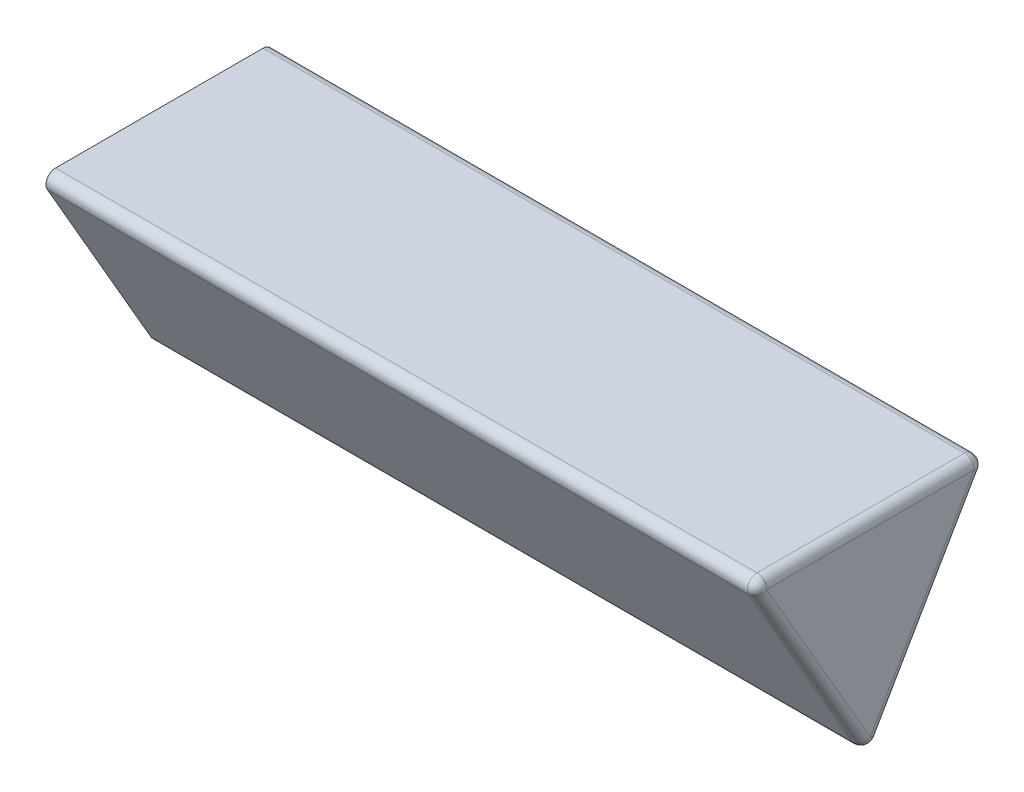
from build123d import *

# Parameters (mm, degrees)
BOSS_EXTRUDE2_DEPTH = 187.452
CUT_EXTRUDE1_DEPTH  = 186.182
FILLET1_R           = 2.54
FILLET2_R           = 2.54


with BuildPart() as part:
    # Sketch2 → Boss-Extrude2 (new body)
    with BuildSketch(Plane(origin=(0, 0, 0), x_dir=(0, 0, -1), z_dir=(1, 0, 0))):
        Polygon((31.75, 18.330871047), (-31.75, 18.330871047), (0, -36.661742094), align=None)
    extrude(amount=BOSS_EXTRUDE2_DEPTH)

    # Sketch3 → Cut-Extrude1 (cut)
    with BuildSketch(Plane(origin=(0, 0, 0), x_dir=(0, 0, -1), z_dir=(1, 0, 0))):
        Polygon((30.1625, 17.414327494), (-30.1625, 17.414327494), (0, -34.828654989), align=None)
    extrude(amount=CUT_EXTRUDE1_DEPTH, mode=Mode.SUBTRACT)

    # Fillet1
    fillet1_edges = [part.edges().sort_by_distance(p)[0] for p in [
        (93.091, -34.828654989, 0),
        (93.091, 17.414327494, -30.1625),
        (93.091, 17.414327494, 30.1625),
        (93.726, -36.661742094, 0),
        (93.726, 18.330871047, 31.75),
        (93.726, 18.330871047, -31.75),
    ]]
    fillet(fillet1_edges, radius=FILLET1_R)

    # Fillet2
    fillet2_edges = [part.edges().sort_by_distance(p)[0] for p in [
        (186.182, -8.707163747, 15.08125),
        (186.182, -8.707163747, -15.08125),
        (186.182, 17.414327494, 0),
        (186.182, 16.144327494, -27.962795474),
        (186.182, 16.144327494, 27.962795474),
        (186.182, -32.288654989, 0),
        (187.452, -9.165435523, -15.875),
        (187.452, -9.165435523, 15.875),
        (187.452, 18.330871047, 0),
        (187.452, 17.060871047, -29.550295474),
        (187.452, 17.060871047, 29.550295474),
        (187.452, -34.121742094, 0),
    ]]
    fillet(fillet2_edges, radius=FILLET2_R)


solid = part.part
